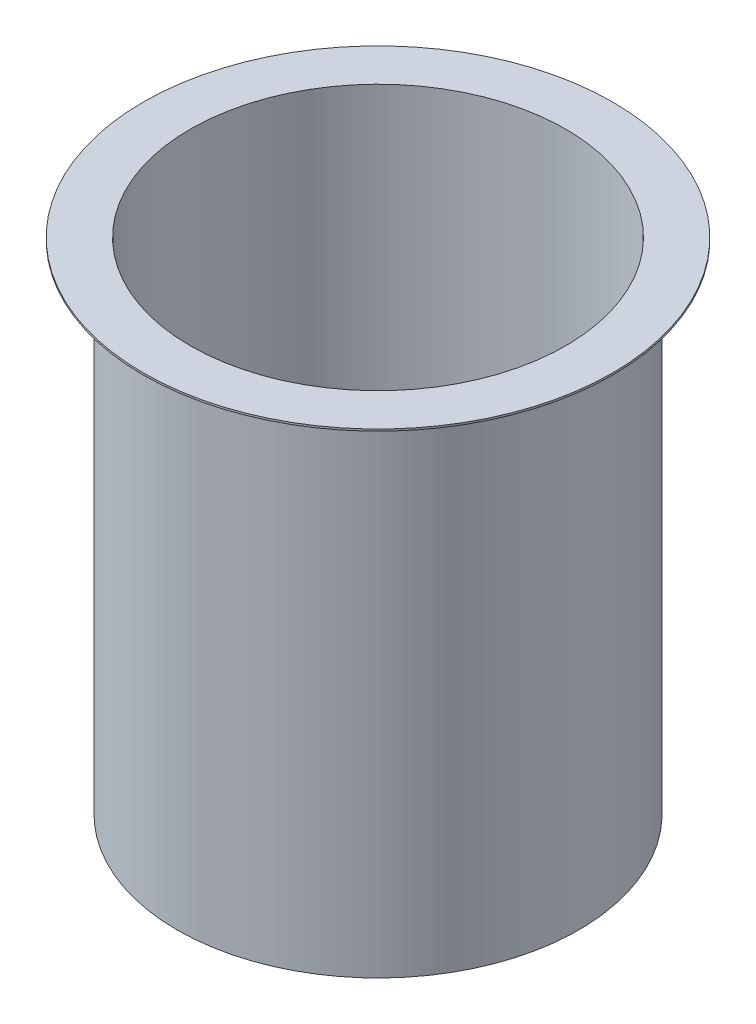
from build123d import *

# Parameters (mm, degrees)
SKETCH1_R           = 27.178
SKETCH1_R_2         = 25.4
BOSS_EXTRUDE1_DEPTH = 67.31
SKETCH2_R           = 31.75
SKETCH2_R_2         = 25.4
BOSS_EXTRUDE2_DEPTH = 0.254


with BuildPart() as part:
    # Sketch1 → Boss-Extrude1 (new body)
    with BuildSketch(Plane(origin=(0, 0, 0), x_dir=(1, 0, 0), z_dir=(0, 1, 0))):
        with Locations(Location((0, 0, 0), (0, 0, 270))):
            Circle(SKETCH1_R)
        with Locations(Location((0, 0, 0), (0, 0, 270))):
            Circle(SKETCH1_R_2, mode=Mode.SUBTRACT)
    extrude(amount=BOSS_EXTRUDE1_DEPTH)

    # Sketch2 → Boss-Extrude2 (add)
    with BuildSketch(Plane(origin=(0, 67.31, 0), x_dir=(1, 0, 0), z_dir=(0, 1, 0))):
        with Locations(Location((0, 0, 0), (0, 0, 270))):
            Circle(SKETCH2_R)
        with Locations(Location((0, 0, 0), (0, 0, 270))):
            Circle(SKETCH2_R_2, mode=Mode.SUBTRACT)
    extrude(amount=BOSS_EXTRUDE2_DEPTH)


solid = part.part
